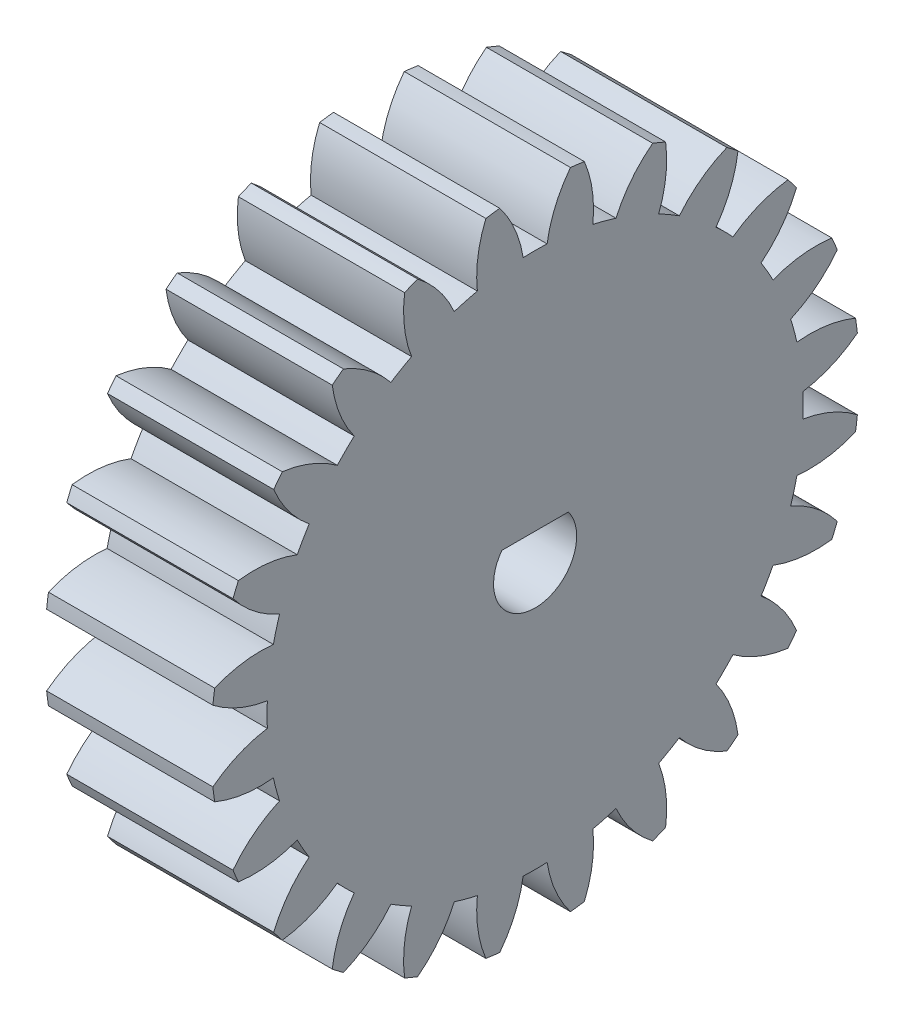
from build123d import *

# Parameters (mm, degrees)
BASPROSKE_W         = 10
BASPROSKE_H         = 19.5
TOOTHCUT_DEPTH      = 30.334280288
TEETHCUTS_COUNT     = 24
TEETHCUTS_ANGLE     = 345
BORSKE_R            = 2.5
BORE_DEPTH          = 50.0000508
BOSS_EXTRUDE1_DEPTH = 10


with BuildPart() as part:
    # BasProSke → Base-Revolve (revolve)
    with BuildSketch(Plane(origin=(0, 0, 0), x_dir=(1, 0, 0), z_dir=(0, 1, 0)), mode=Mode.PRIVATE) as base_revolve_sk:
        with Locations((5, 9.75)):
            Rectangle(BASPROSKE_W, BASPROSKE_H)
    revolve(base_revolve_sk.sketch.rotate(Axis((-10, 0, 0), (1, 0, 0)), 180), axis=Axis((-10, 0, 0), (1, 0, 0)))

    # TooCutSke → ToothCut (cut, through all)
    with BuildSketch(Plane(origin=(0, 0, 0), x_dir=(0, 0, -1), z_dir=(1, 0, 0))):
        with BuildLine():
            ThreePointArc((0.718975251, 16.107962335), (0, 16.124), (-0.718975251, 16.107962335))
            ThreePointArc((-0.718975251, 16.107962335), (-1.222639001, 17.848001425), (-2.144665446, 19.407257799))
            ThreePointArc((-2.144665446, 19.407257799), (0, 19.5254), (2.144665446, 19.407257799))
            ThreePointArc((2.144665446, 19.407257799), (1.222639001, 17.848001425), (0.718975251, 16.107962335))
        make_face()
    toothcut = extrude(amount=TOOTHCUT_DEPTH, mode=Mode.SUBTRACT)

    # TeethCuts: ToothCut ×24 about axis
    teethcuts_axis = Axis((-10, 0, 0), (1, 0, 0))
    for i in range(1, TEETHCUTS_COUNT):
        add(toothcut.rotate(teethcuts_axis, i * TEETHCUTS_ANGLE / (TEETHCUTS_COUNT - 1)), mode=Mode.SUBTRACT)

    # BorSke → Bore (cut, symmetric)
    with BuildSketch(Plane(origin=(0, 0, 0), x_dir=(0, 0, -1), z_dir=(1, 0, 0))):
        with Locations(Location((0, 0, 0), (0, 0, 180))):
            Circle(BORSKE_R)
    extrude(amount=BORE_DEPTH, both=True, mode=Mode.SUBTRACT)

    # Sketch1 → Boss-Extrude1 (add)
    with BuildSketch(Plane(origin=(10, 0, 0), x_dir=(0, 0, -1), z_dir=(1, 0, 0))):
        with BuildLine():
            Line((-2, 1.5), (2, 1.5))
            ThreePointArc((2, 1.5), (0, 2.5), (-2, 1.5))
        make_face()
    extrude(amount=-BOSS_EXTRUDE1_DEPTH)


solid = part.part
